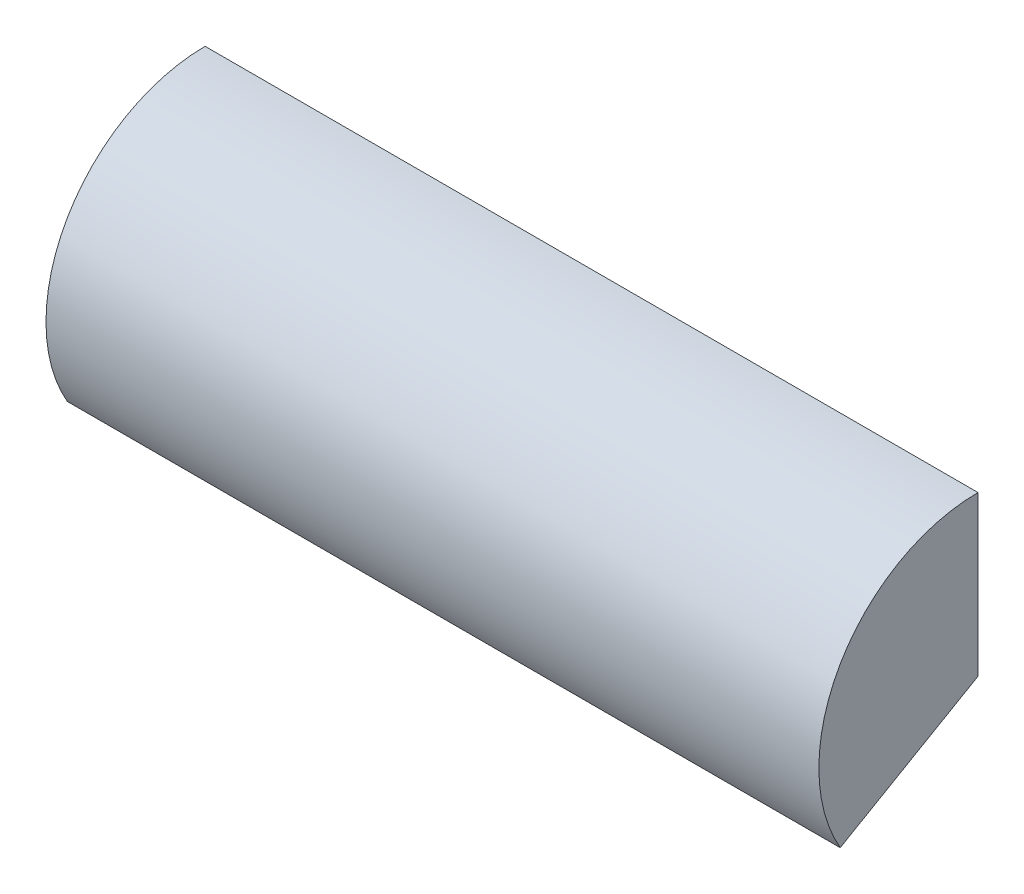
from build123d import *

# Parameters (mm, degrees)
SKETCH1_W      = 44.45
SKETCH1_H      = 215.9
REVOLVE1_ANGLE = 120


with BuildPart() as part:
    # Sketch1 → Revolve1 (revolve)
    with BuildSketch(Plane(origin=(0, 0, 0), x_dir=(0, 1, 0), z_dir=(0, 0, 1))):
        with Locations((22.225, 107.95)):
            Rectangle(SKETCH1_W, SKETCH1_H)
    revolve(axis=Axis((0, 0, 0), (1, 0, 0)), revolution_arc=REVOLVE1_ANGLE)

    # Sketch21 → Cut-Revolve21 (revolve, cut)
    with BuildSketch(Plane(origin=(0, 0, 0), x_dir=(-1, 0, 0), z_dir=(0, 0, -1))):
        with BuildLine():
            Line((3.81, 0), (193.361475911, 0))
            Line((193.361475911, 0), (193.361555592, 1.489862296))
            Line((193.361555592, 1.489862296), (73.362678959, 22.496280175))
            Line((73.362678959, 22.496280175), (71.862679183, 22.500563741))
            Line((71.862679183, 22.500563741), (63.809813581, 22.500497032))
            add(Edge.make_bspline(
                [(3.81, 0), (3.409136339, 11.429131598), (63.809813581, 22.500497032)],
                knots=[0, 0, 0, 1, 1, 1], degree=2))
        make_face()
    revolve(axis=Axis((-215.9, 0, 0), (1, 0, 0)), mode=Mode.SUBTRACT)


solid = part.part
